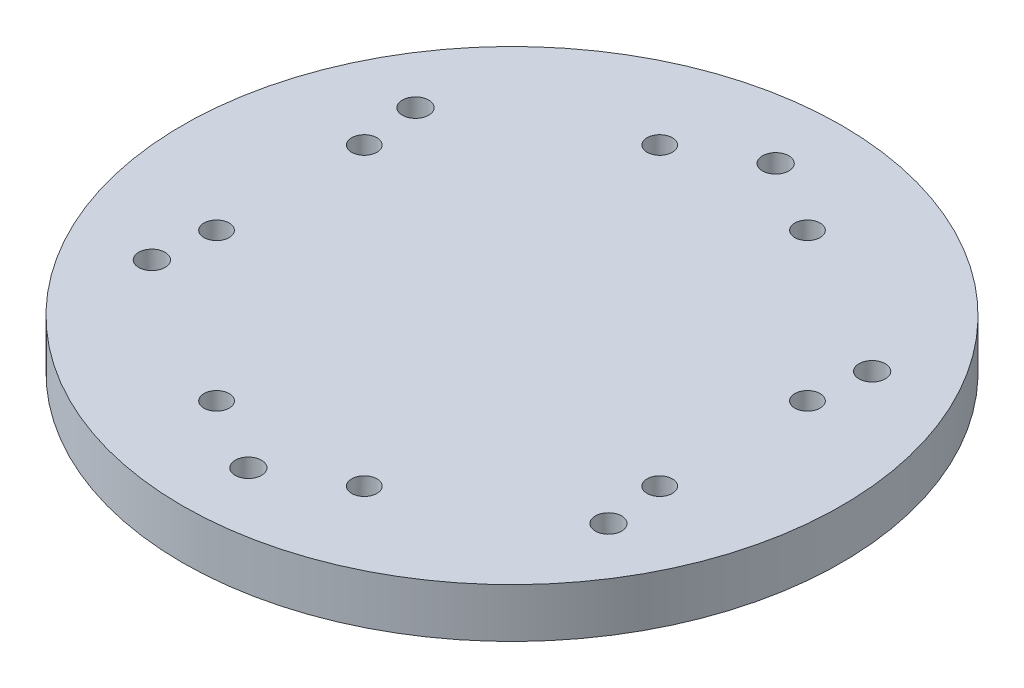
from build123d import *

# Parameters (mm, degrees)
SKETCH1_R                = 85
BOSS_EXTRUDE1_DEPTH      = 12.7
M8X1_25_TAPPED_HOLE1_D   = 6.8
CIRPATTERN3_COUNT        = 6
F_5_16_18_TAPPED_HOLE1_D = 6.5278
CIRPATTERN2_COUNT        = 4


with BuildPart() as part:
    # Sketch1 → Boss-Extrude1 (new body)
    with BuildSketch(Plane(origin=(0, 0, 0), x_dir=(1, 0, 0), z_dir=(0, 1, 0))):
        with Locations(Location((0, 0, 0), (0, 0, 270))):
            Circle(SKETCH1_R)
    extrude(amount=BOSS_EXTRUDE1_DEPTH)

    # M8x1.25 Tapped Hole1 (through all)
    with Locations(Plane(origin=(0, 12.7, 0), x_dir=(1, 0, 0), z_dir=(0, 1, 0))):
        with Locations((0, 68)):
            m8x1_25_tapped_hole1 = Hole(M8X1_25_TAPPED_HOLE1_D / 2)

    # CirPattern3: M8x1.25 Tapped Hole1 ×6 about axis
    cirpattern3_axis = Axis((0, 0, 0), (0, 1, 0))
    for i in range(1, CIRPATTERN3_COUNT):
        add(m8x1_25_tapped_hole1.rotate(cirpattern3_axis, i * 360 / CIRPATTERN3_COUNT), mode=Mode.SUBTRACT)

    # 5/16-18 Tapped Hole1 (through all)
    with Locations(Plane(origin=(0, 0, 0), x_dir=(-1, 0, 0), z_dir=(0, -1, 0))):
        with Locations((-19.049999999, 57.15), (19.049999999, 57.15)):
            f_5_16_18_tapped_hole1 = Hole(F_5_16_18_TAPPED_HOLE1_D / 2)

    # CirPattern2: 5/16-18 Tapped Hole1 ×4 about axis
    cirpattern2_axis = Axis((0, 0, 0), (0, 1, 0))
    for i in range(1, CIRPATTERN2_COUNT):
        add(f_5_16_18_tapped_hole1.rotate(cirpattern2_axis, i * 360 / CIRPATTERN2_COUNT), mode=Mode.SUBTRACT)


solid = part.part
